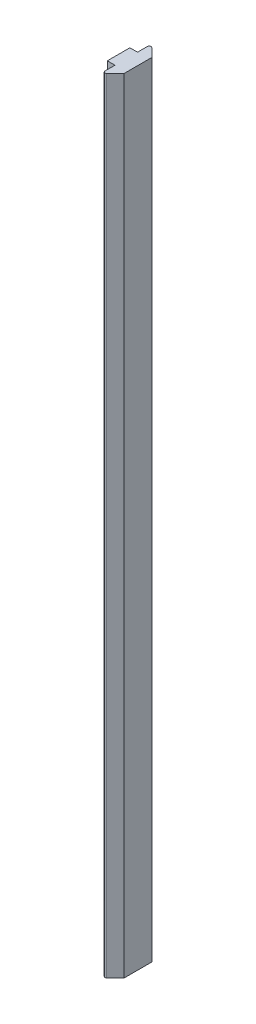
from build123d import *

# Parameters (mm, degrees)
BOSS_EXTRUDE1_DEPTH = 200


with BuildPart() as part:
    # Sketch1 → Boss-Extrude1 (new body)
    with BuildSketch(Plane(origin=(0, 0, 0), x_dir=(1, 0, 0), z_dir=(0, 1, 0))):
        with BuildLine():
            Line((-3.239339866, -2.878050905), (-3.239339866, -5.427441221))
            ThreePointArc((-3.239339866, -5.427441221), (-2.961547411, -5.843187011), (-2.471141815, -5.745639273))
            Line((-2.471141815, -5.745639273), (-0.25, -3.524497458))
            Line((-0.25, -3.524497458), (-0.25, 3.524497458))
            Line((-0.25, 3.524497458), (-2.471141814, 5.745639272))
            ThreePointArc((-2.471141814, 5.745639272), (-2.961547408, 5.84318701), (-3.239339864, 5.427441222))
            Line((-3.239339864, 5.427441222), (-3.239339864, 2.878050849))
            Line((-3.239339864, 2.878050849), (-4.939339838, 2.878050849))
            Line((-4.939339838, 2.878050849), (-5.189339838, 2.878050849))
            Line((-5.189339838, 2.878050849), (-5.189339838, -2.878050905))
            Line((-5.189339838, -2.878050905), (-3.239339866, -2.878050905))
        make_face()
    extrude(amount=BOSS_EXTRUDE1_DEPTH)


solid = part.part
